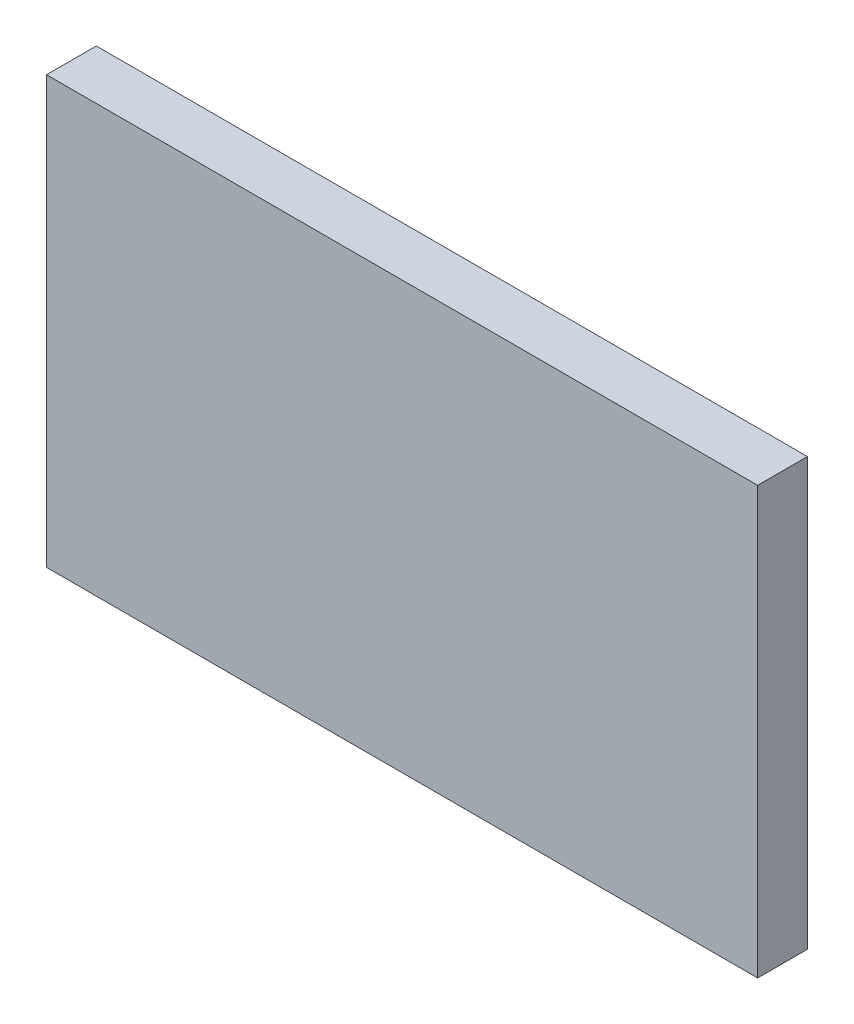
from build123d import *

# Parameters (mm, degrees)
SKETCH1_W           = 100
SKETCH1_H           = 60
BOSS_EXTRUDE1_DEPTH = 10
SKETCH1_2_W         = 100
SKETCH1_2_H         = 60
CUT_EXTRUDE1_DEPTH  = 3


with BuildPart() as part:
    # Sketch1 → Boss-Extrude1 (new body)
    with BuildSketch(Plane.XY):
        Rectangle(SKETCH1_W, SKETCH1_H)
    extrude(amount=BOSS_EXTRUDE1_DEPTH)

    # Sketch1<2> → Cut-Extrude1 (cut)
    with BuildSketch(Plane.XY):
        Rectangle(SKETCH1_2_W, SKETCH1_2_H)
    extrude(amount=CUT_EXTRUDE1_DEPTH, mode=Mode.SUBTRACT)


solid = part.part
